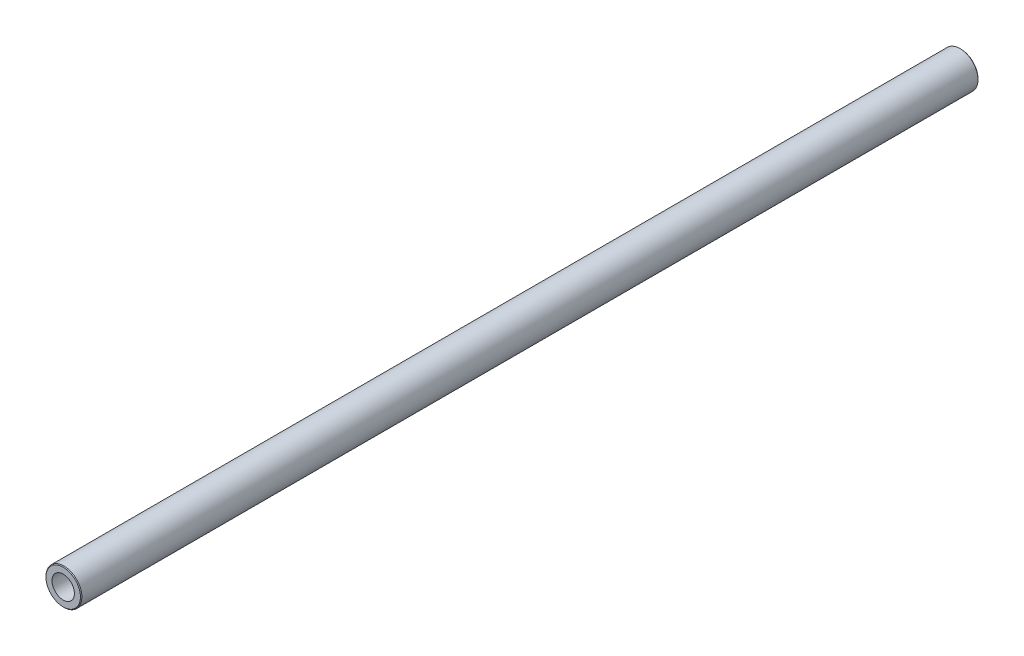
from build123d import *

# Parameters (mm, degrees)
BOSS_EXTRUDE1_DEPTH                 = 100
BOSS_EXTRUDE1_DEPTH_BACK            = 100
SKETCH3_R                           = 4
CHAMFER1_SIZE                       = 0.16
M6X1_0_TAPPED_HOLE1_D               = 5
M6X1_0_TAPPED_HOLE1_DEPTH           = 25
M6X1_0_TAPPED_HOLE1_TIP             = 1.502151548
M6X1_0_TAPPED_HOLE1_ON_FACE_2_D     = 5
M6X1_0_TAPPED_HOLE1_ON_FACE_2_DEPTH = 25
M6X1_0_TAPPED_HOLE1_ON_FACE_2_TIP   = 1.502151548


with BuildPart() as part:
    # Sketch3 → Boss-Extrude1 (new, two sides: drawn at the far end of the back side and taken through both)
    with BuildSketch(Plane.XY.offset(-BOSS_EXTRUDE1_DEPTH_BACK)):
        Circle(SKETCH3_R)
    extrude(amount=BOSS_EXTRUDE1_DEPTH + BOSS_EXTRUDE1_DEPTH_BACK)

    # Chamfer1
    chamfer1_edges = [part.edges().sort_by_distance(p)[0] for p in [
        (-4, 0, -100),
        (-4, 0, 100),
    ]]
    chamfer(chamfer1_edges, length=CHAMFER1_SIZE)

    # M6x1.0 Tapped Hole1
    with Locations(Plane.XY.offset(100)):
        with Locations((0, 0)):
            Hole(M6X1_0_TAPPED_HOLE1_D / 2, depth=M6X1_0_TAPPED_HOLE1_DEPTH)
            with Locations((0, 0, -(M6X1_0_TAPPED_HOLE1_DEPTH + M6X1_0_TAPPED_HOLE1_TIP / 2))):  # 118° drill point
                Cone(0, M6X1_0_TAPPED_HOLE1_D / 2, M6X1_0_TAPPED_HOLE1_TIP, mode=Mode.SUBTRACT)

    # M6x1.0 Tapped Hole1 on face 2
    with Locations(Plane(origin=(0, 0, -100), x_dir=(-1, 0, 0), z_dir=(0, 0, -1))):
        with Locations((0, 0)):
            Hole(M6X1_0_TAPPED_HOLE1_ON_FACE_2_D / 2, depth=M6X1_0_TAPPED_HOLE1_ON_FACE_2_DEPTH)
            with Locations((0, 0, -(M6X1_0_TAPPED_HOLE1_ON_FACE_2_DEPTH + M6X1_0_TAPPED_HOLE1_ON_FACE_2_TIP / 2))):  # 118° drill point
                Cone(0, M6X1_0_TAPPED_HOLE1_ON_FACE_2_D / 2, M6X1_0_TAPPED_HOLE1_ON_FACE_2_TIP, mode=Mode.SUBTRACT)


solid = part.part
